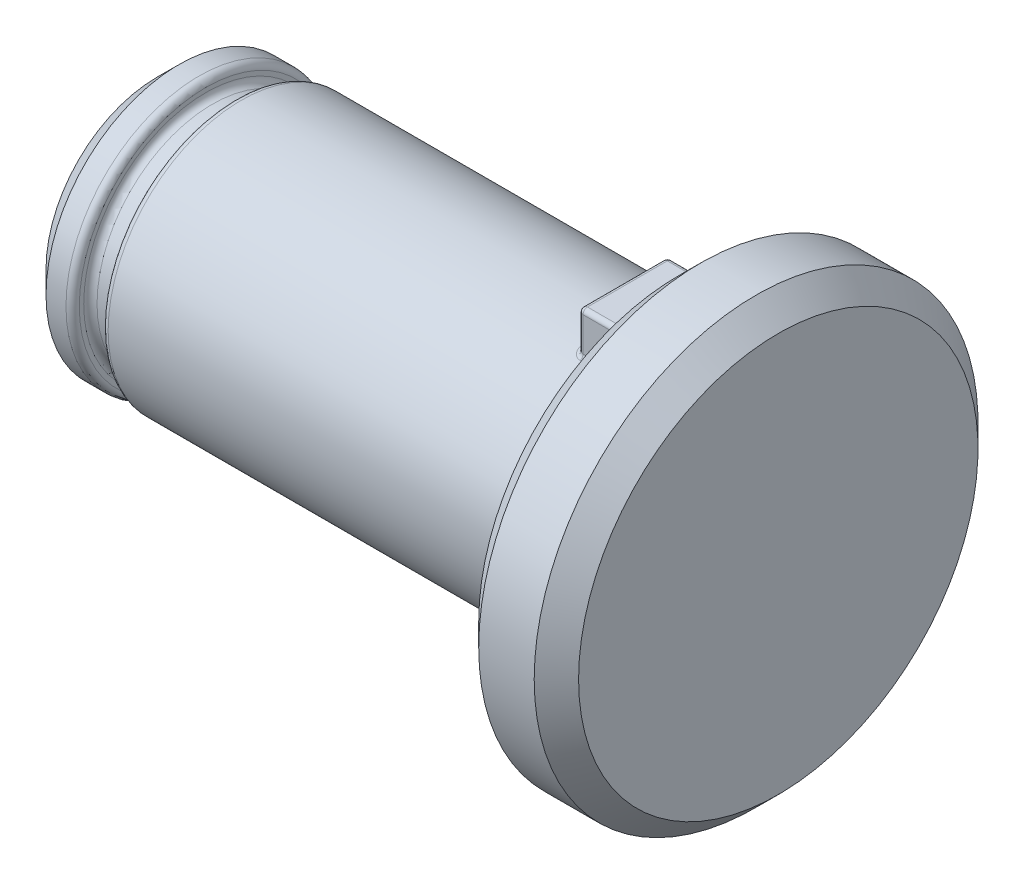
from build123d import *

# Parameters (mm, degrees)
BOSS_EXTRUDE1_DEPTH = 2.5
FILLET1_R           = 0.2
SKETCH3_R           = 3.1
CUT_EXTRUDE1_DEPTH  = 2.5
FILLET2_R           = 0.1


with BuildPart() as part:
    # Sketch1 → Revolve1 (revolve)
    with BuildSketch(Plane(origin=(0, 0, 0), x_dir=(-1, 0, 0), z_dir=(0, 1, 0))):
        with BuildLine():
            Line((-1, 10), (-3.5, 10))
            Line((-3.5, 10), (-4.5, 9))
            Line((-4.5, 9), (-4.5, 0))
            Line((-4.5, 0), (23.5, 0))
            Line((23.5, 0), (23.5, 5))
            Line((23.5, 5), (22.5, 6))
            Line((22.5, 6), (21.6, 6))
            ThreePointArc((21.6, 6), (21.387867966, 5.912132034), (21.3, 5.7))
            Line((21.3, 5.7), (21.3, 5.5))
            ThreePointArc((21.3, 5.5), (21.212132034, 5.287867966), (21, 5.2))
            Line((21, 5.2), (20.3, 5.2))
            ThreePointArc((20.3, 5.2), (20.087867966, 5.287867966), (20, 5.5))
            Line((20, 5.5), (20, 5.7))
            ThreePointArc((20, 5.7), (19.912132034, 5.912132034), (19.7, 6))
            Line((19.7, 6), (2, 6))
            ThreePointArc((2, 6), (0.585786438, 6.585786438), (0, 8))
            Line((0, 8), (0, 9))
            Line((0, 9), (-1, 10))
        make_face()
    revolve(axis=Axis((-23.5, 0, 0), (1, 0, 0)))

    # Sketch2 → Boss-Extrude1 (add)
    with BuildSketch(Plane(origin=(0, 0, 0), x_dir=(0, -1, 0), z_dir=(-1, 0, 0))):
        with BuildLine():
            Line((5.656854249, 2), (7.531854249, 2))
            Line((7.531854249, 2), (7.531854249, -2))
            Line((7.531854249, -2), (5.656854249, -2))
            ThreePointArc((5.656854249, -2), (6, 0), (5.656854249, 2))
        make_face()
        with BuildLine():
            Line((-5.656854249, -2), (-7.531854249, -2))
            Line((-7.531854249, -2), (-7.531854249, 2))
            Line((-7.531854249, 2), (-5.656854249, 2))
            ThreePointArc((-5.656854249, 2), (-6, 0), (-5.656854249, -2))
        make_face()
    extrude(amount=BOSS_EXTRUDE1_DEPTH)

    # Fillet1
    fillet1_edges = [part.edges().sort_by_distance(p)[0] for p in [
        (-0.055561892, 7.531854249, 0),
        (-0.055561892, -7.531854249, 0),
        (-2.25, -5.656854249, 2),
        (-1.255377294, -7.531854249, -2),
        (-1.255377294, -7.531854249, 2),
        (-2.25, -5.656854249, -2),
        (-1.255377294, -7.531854249, -2),
        (-1.255377294, -7.531854249, 2),
        (-2.5, -6, 0),
        (-2.5, -6.594354249, -2),
        (-2.5, -7.531854249, 0),
        (-2.5, -6.594354249, 2),
        (-2.25, 5.656854249, -2),
        (-1.255377294, 7.531854249, 2),
        (-1.255377294, 7.531854249, -2),
        (-2.25, 5.656854249, 2),
        (-1.255377294, 7.531854249, 2),
        (-1.255377294, 7.531854249, -2),
        (-2.5, 6, 0),
        (-2.5, 6.594354249, 2),
        (-2.5, 7.531854249, 0),
        (-2.5, 6.594354249, -2),
    ]]
    fillet(fillet1_edges, radius=FILLET1_R)

    # Sketch3 → Cut-Extrude1 (cut)
    with BuildSketch(Plane(origin=(-23.5, 0, 0), x_dir=(0, -1, 0), z_dir=(-1, 0, 0))):
        with Locations(Location((0, 0, 0), (0, 0, 90))):
            Circle(SKETCH3_R)
    extrude(amount=-CUT_EXTRUDE1_DEPTH, mode=Mode.SUBTRACT)

    # Fillet2
    fillet2_edges = [part.edges().sort_by_distance(p)[0] for p in [
        (-21, 0, -3.1),
        (-23.5, 0, -3.1),
    ]]
    fillet(fillet2_edges, radius=FILLET2_R)


solid = part.part
